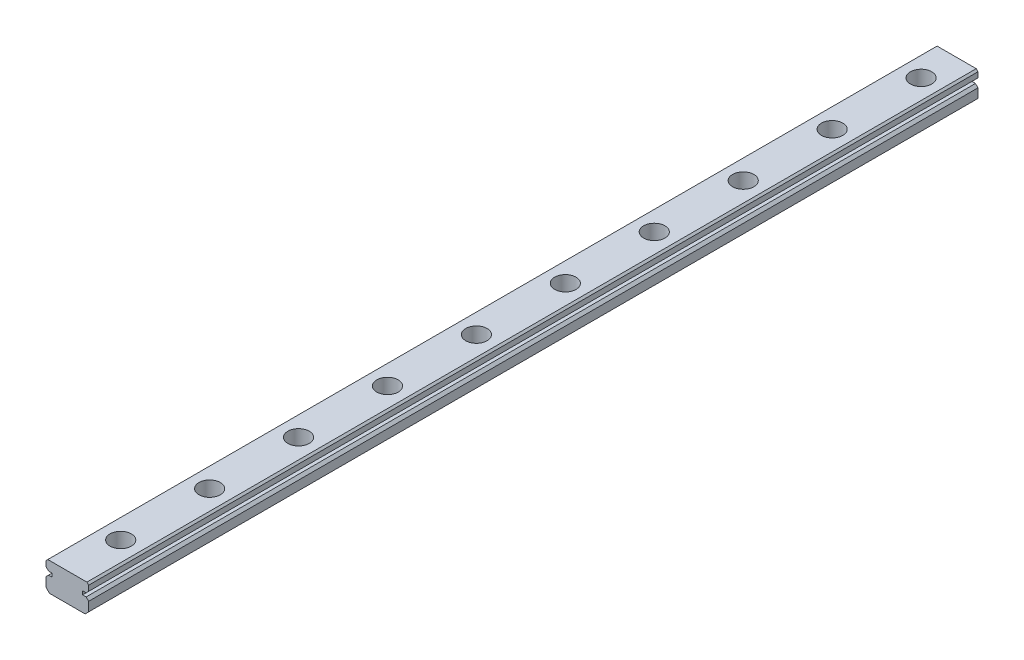
from build123d import *

# Parameters (mm, degrees)
MAIN_EXTRUSION_DEPTH             = 250
MOUNTING_HOLE_MASTER_D           = 3.5
MOUNTING_HOLE_MASTER_DEPTH       = 9.921567416
MOUNTING_HOLE_MASTER_CBORE_D     = 6
MOUNTING_HOLE_MASTER_CBORE_DEPTH = 4.5
MOUNTING_HOLES_PATTERN_COUNT     = 10
MOUNTING_HOLES_PATTERN_PITCH     = 25
RAIL_TOP_CHAMFER_SIZE            = 0.5
RAIL_BOTTOM_CHAMFER_SIZE         = 1


with BuildPart() as part:
    # MainProfile → Main Extrusion (new body)
    with BuildSketch(Plane.XY):
        Polygon((0, 0), (0, 3.585786438), (0.707106781, 4.292893219), (1.707106781, 4.292893219), (1.707106781, 5.292893219), (0.707106781, 5.292893219), (0, 6), (0, 8), (12, 8), (12, 6), (11.292893219, 5.292893219), (10.292893219, 5.292893219), (10.292893219, 4.292893219), (11.292893219, 4.292893219), (12, 3.585786438), (12, 0), align=None)
    extrude(amount=MAIN_EXTRUSION_DEPTH)

    # Mounting Hole Master
    with Locations(Plane(origin=(0, 8, 0), x_dir=(1, 0, 0), z_dir=(0, 1, 0))):
        with Locations((6, -10)):
            mounting_hole_master = CounterBoreHole(MOUNTING_HOLE_MASTER_D / 2, MOUNTING_HOLE_MASTER_CBORE_D / 2, MOUNTING_HOLE_MASTER_CBORE_DEPTH, depth=MOUNTING_HOLE_MASTER_DEPTH)

    # Mounting Holes Pattern: Mounting Hole Master ×10
    with Locations(*[(0, 0, i * MOUNTING_HOLES_PATTERN_PITCH) for i in range(1, MOUNTING_HOLES_PATTERN_COUNT)]):
        add(mounting_hole_master, mode=Mode.SUBTRACT)

    # Rail Top Chamfer
    rail_top_chamfer_edges = [part.edges().sort_by_distance(p)[0] for p in [
        (12, 8, 125),
        (0, 8, 125),
    ]]
    chamfer(rail_top_chamfer_edges, length=RAIL_TOP_CHAMFER_SIZE)

    # Rail Bottom Chamfer
    rail_bottom_chamfer_edges = [part.edges().sort_by_distance(p)[0] for p in [
        (0, 0, 125),
        (12, 0, 125),
    ]]
    chamfer(rail_bottom_chamfer_edges, length=RAIL_BOTTOM_CHAMFER_SIZE)


solid = part.part
